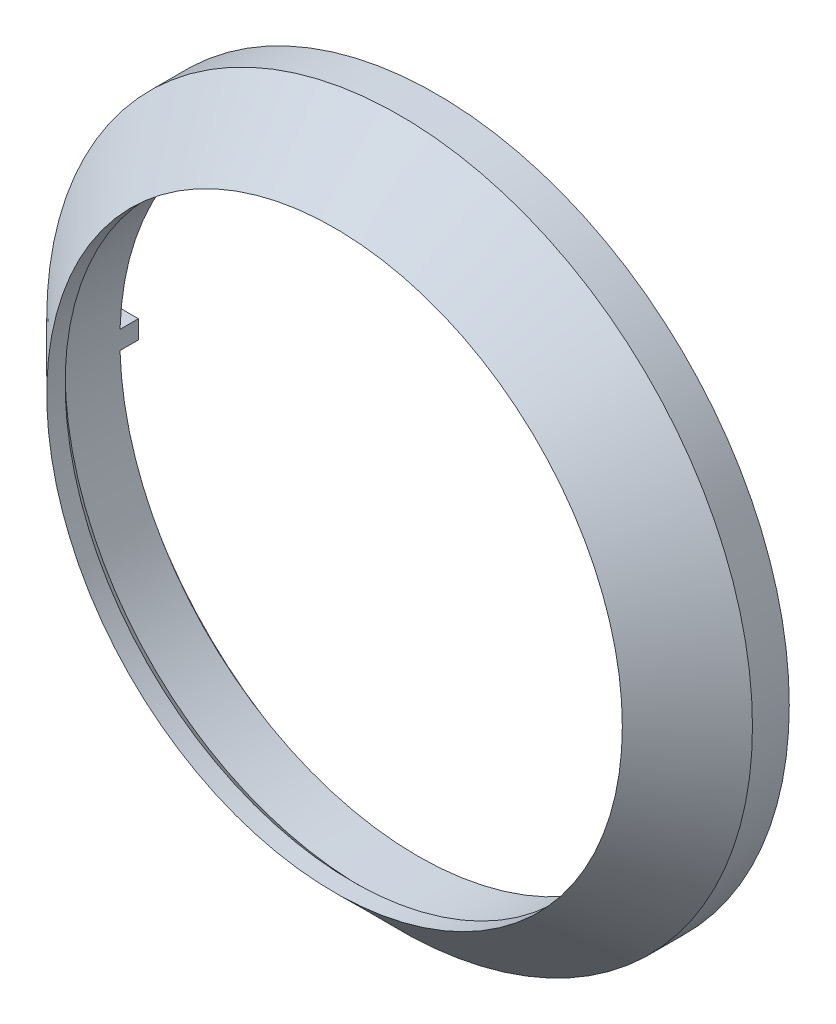
from build123d import *
from build123d.topology import SkipClean

# Parameters (mm, degrees)
BOSS_EXTRU_1_START = 5
BOSS_EXTRU_1_DEPTH = 5


with BuildPart() as part:
    # Esquisse1 → Révolution1 (revolve)
    with BuildSketch(Plane(origin=(0, 0, 0), x_dir=(1, 0, 0), z_dir=(0, 1, 0)), mode=Mode.PRIVATE) as r_volution1_sk:
        Polygon((-95.869703244, 5), (-95.869703244, -5), (-78.192033714, -22.67766953), (-78.192033714, -17.67766953), (-81, -14.869703244), (-81, 0), (-87.869703244, 0), (-87.869703244, 5), align=None)
    revolve(r_volution1_sk.sketch.rotate(Axis((0, 0, 0), (0, 0, -1)), 180), axis=Axis((0, 0, 0), (0, 0, -1)))

    # Esquisse6 → Boss.-Extru.1 (add)
    with SkipClean():  # the faces are left unmerged after this step: merging them gives an invalid solid
        with BuildSketch(Plane(origin=(0, 0, 0), x_dir=(-1, 0, 0), z_dir=(0, 0, -1)).offset(BOSS_EXTRU_1_START)):
            with BuildLine():
                Line((80.961410561, -2.5), (87.834132022, -2.5))
                ThreePointArc((87.834132022, -2.5), (87.869703244, 0), (87.834132022, 2.5))
                Line((87.834132022, 2.5), (80.961410561, 2.5))
                ThreePointArc((80.961410561, 2.5), (81, 0), (80.961410561, -2.5))
            make_face()
        boss_extru_1 = extrude(amount=-BOSS_EXTRU_1_DEPTH)

    # Symétrie1: Boss.-Extru.1 across plane
    add(boss_extru_1.mirror(Plane(origin=(0, 0, 0), x_dir=(0, 0, 1), z_dir=(1, 0, 0))))


solid = part.part
